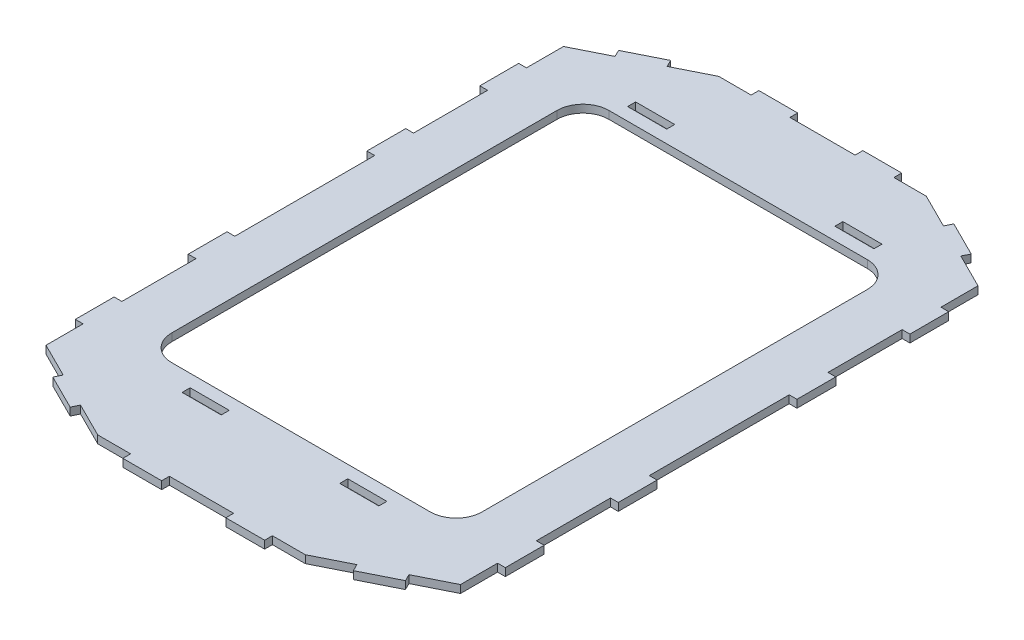
from build123d import *

# Parameters (mm, degrees)
SKETCH1_W           = 15.1
SKETCH1_H           = 3.1
BOSS_EXTRUDE1_DEPTH = 3


with BuildPart() as part:
    # Sketch1 → Boss-Extrude1 (new body)
    with BuildSketch(Plane(origin=(0, 0, 0), x_dir=(1, 0, 0), z_dir=(0, 1, 0))):
        Polygon((22.496777959, -120.1354094), (35.788574027, -113.489511367), (37.130214813, -116.17279294), (50.546622678, -109.464589007), (49.204981892, -106.781307434), (62.496777959, -100.1354094), (62.496777959, -85.8129094), (65.496777959, -85.8129094), (65.496777959, -70.8129094), (62.496777959, -70.8129094), (62.496777959, -42.1679094), (65.496777959, -42.1679094), (65.496777959, -27.1679094), (62.496777959, -27.1679094), (62.496777959, 2.411735491), (62.496777959, 26.8970906), (65.496777959, 26.8970906), (65.496777959, 41.8970906), (62.496777959, 41.8970906), (62.496777959, 70.5420906), (65.496777959, 70.5420906), (65.496777959, 85.5420906), (62.496777959, 85.5420906), (62.496777959, 99.8645906), (49.204981892, 106.510488633), (50.546622678, 109.193770206), (37.130214813, 115.901974139), (35.788574027, 113.218692566), (22.496777959, 119.8645906), (9.996777959, 119.8645906), (9.996777959, 122.8645906), (-5.003222041, 122.8645906), (-5.003222041, 119.8645906), (-30.203222041, 119.8645906), (-30.203222041, 122.8645906), (-45.203222041, 122.8645906), (-45.203222041, 119.8645906), (-57.703222041, 119.8645906), (-70.995018108, 113.218692566), (-72.336658895, 115.901974139), (-85.75306676, 109.193770206), (-84.411425973, 106.510488633), (-97.703222041, 99.8645906), (-97.703222041, 85.5420906), (-100.703222041, 85.5420906), (-100.703222041, 70.5420906), (-97.703222041, 70.5420906), (-97.703222041, 41.8970906), (-100.703222041, 41.8970906), (-100.703222041, 26.8970906), (-97.703222041, 26.8970906), (-97.703222041, 2.411735491), (-97.703222041, -27.1679094), (-100.703222041, -27.1679094), (-100.703222041, -42.1679094), (-97.703222041, -42.1679094), (-97.703222041, -70.8129094), (-100.703222041, -70.8129094), (-100.703222041, -85.8129094), (-97.703222041, -85.8129094), (-97.703222041, -100.1354094), (-84.411425973, -106.781307434), (-85.75306676, -109.464589007), (-72.336658895, -116.17279294), (-70.995018108, -113.489511367), (-57.703222041, -120.1354094), (-45.003222041, -120.1354094), (-45.003222041, -123.1354094), (-30.003222041, -123.1354094), (-30.003222041, -120.1354094), (-5.203222041, -120.1354094), (-5.203222041, -123.1354094), (9.796777959, -123.1354094), (9.796777959, -120.1354094), align=None)
        with Locations((-57.653222041, 93.700471208)):
            Rectangle(SKETCH1_W, SKETCH1_H, mode=Mode.SUBTRACT)
        with Locations((-48.060490447, -88.062310774)):
            Rectangle(SKETCH1_W, SKETCH1_H, mode=Mode.SUBTRACT)
        with Locations((22.446777959, 93.700471208)):
            Rectangle(SKETCH1_W, SKETCH1_H, mode=Mode.SUBTRACT)
        with Locations((12.854046365, -88.062310774)):
            Rectangle(SKETCH1_W, SKETCH1_H, mode=Mode.SUBTRACT)
        with BuildLine():
            Line((-67.551147117, 87.238656666), (32.344703035, 87.238656666))
            ThreePointArc((32.344703035, 87.238656666), (39.415770847, 84.309724478), (42.344703035, 77.238656666))
            Line((42.344703035, 77.238656666), (42.344703035, -71.663891856))
            ThreePointArc((42.344703035, -71.663891856), (39.415770847, -78.734959668), (32.344703035, -81.663891856))
            Line((32.344703035, -81.663891856), (-67.551147117, -81.663891856))
            ThreePointArc((-67.551147117, -81.663891856), (-74.622214928, -78.734959668), (-77.551147117, -71.663891856))
            Line((-77.551147117, -71.663891856), (-77.551147117, 77.238656666))
            ThreePointArc((-77.551147117, 77.238656666), (-74.622214928, 84.309724478), (-67.551147117, 87.238656666))
        make_face(mode=Mode.SUBTRACT)
    extrude(amount=BOSS_EXTRUDE1_DEPTH)


solid = part.part
